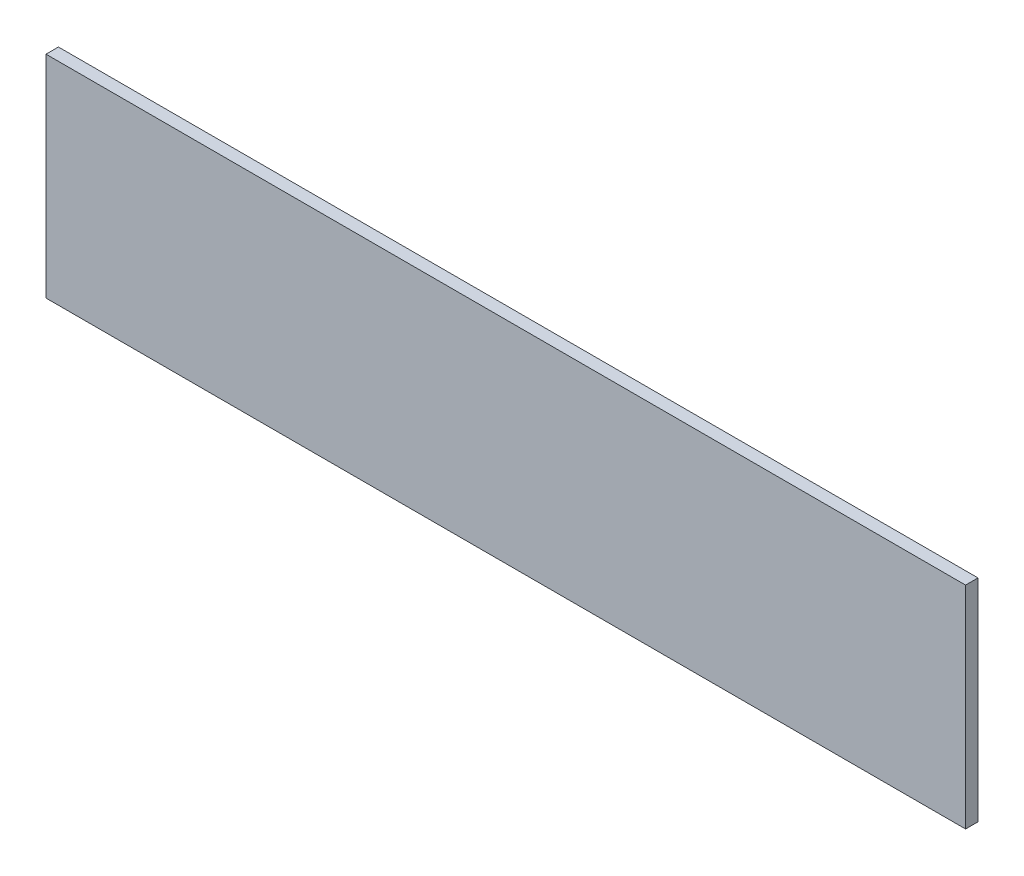
from build123d import *

# Parameters (mm, degrees)
SKETCH1_W           = 234.95
SKETCH1_H           = 53.975
BOSS_EXTRUDE2_DEPTH = 3.175


with BuildPart() as part:
    # Sketch1 → Boss-Extrude2 (new body)
    with BuildSketch(Plane.XY):
        with Locations((-117.475, 33.214090106)):
            Rectangle(SKETCH1_W, SKETCH1_H)
    extrude(amount=BOSS_EXTRUDE2_DEPTH)


solid = part.part
